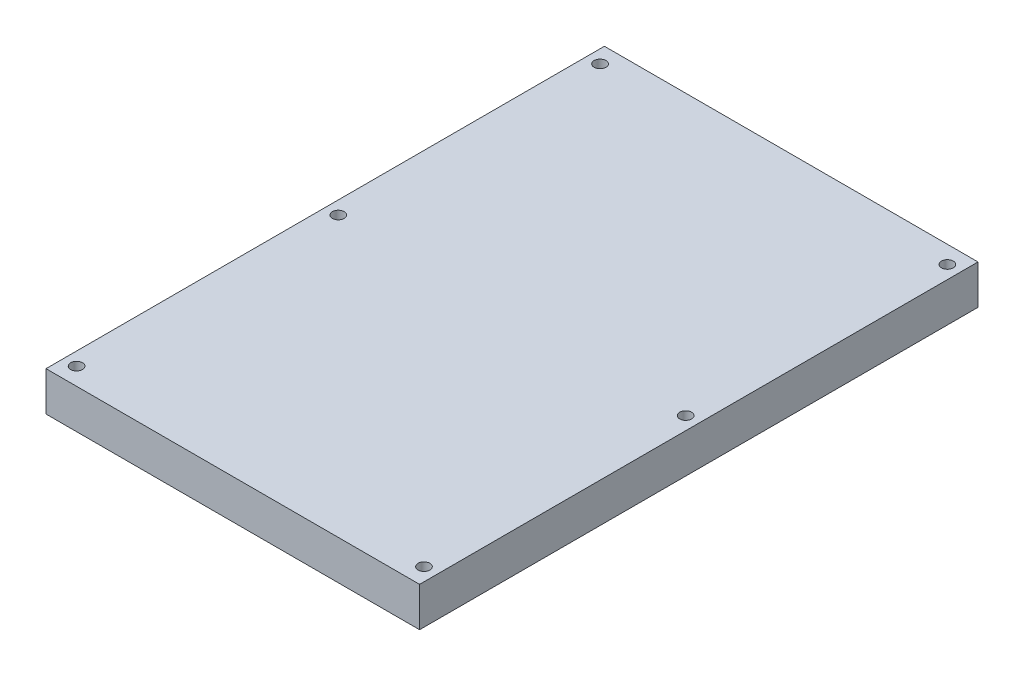
from build123d import *

# Parameters (mm, degrees)
SKETCH1_W                 = 85.5
SKETCH1_H                 = 127.8
BOSS_EXTRUDE1_DEPTH       = 9
TAP_DRILL_FOR_6_32_TAP1_D = 2.7051
LPATTERN1_COUNT           = 3
LPATTERN1_PITCH           = 59.9
MIRROR1_COPY_1_D          = 2.7051
MIRROR1_COPY_2_D          = 2.7051


with BuildPart() as part:
    # Sketch1 → Boss-Extrude1 (new body)
    with BuildSketch(Plane(origin=(0, 0, 0), x_dir=(1, 0, 0), z_dir=(0, 1, 0))):
        with Locations((42.75, 63.9)):
            Rectangle(SKETCH1_W, SKETCH1_H)
    extrude(amount=BOSS_EXTRUDE1_DEPTH)

    # Tap Drill for #6-32 Tap1 (through all)
    with Locations(Plane(origin=(0, 9, 0), x_dir=(1, 0, 0), z_dir=(0, 1, 0))):
        with Locations((82.5, 4)):
            tap_drill_for_6_32_tap1 = Hole(TAP_DRILL_FOR_6_32_TAP1_D / 2)

    # LPattern1: Tap Drill for #6-32 Tap1 ×3
    with Locations(*[(0, 0, -i * LPATTERN1_PITCH) for i in range(1, LPATTERN1_COUNT)]):
        add(tap_drill_for_6_32_tap1, mode=Mode.SUBTRACT)

    # Mirror1: Tap Drill for #6-32 Tap1 across plane
    add(tap_drill_for_6_32_tap1.mirror(Plane(origin=(42.75, 0, 0), x_dir=(0, 0, 1), z_dir=(1, 0, 0))), mode=Mode.SUBTRACT)

    # Mirror1 copy 1 (through all)
    with Locations(Plane(origin=(85.5, 9, -59.9), x_dir=(-1, 0, 0), z_dir=(0, 1, 0))):
        with Locations((82.5, -4)):
            Hole(MIRROR1_COPY_1_D / 2)

    # Mirror1 copy 2 (through all)
    with Locations(Plane(origin=(85.5, 9, -119.8), x_dir=(-1, 0, 0), z_dir=(0, 1, 0))):
        with Locations((82.5, -4)):
            Hole(MIRROR1_COPY_2_D / 2)


solid = part.part
